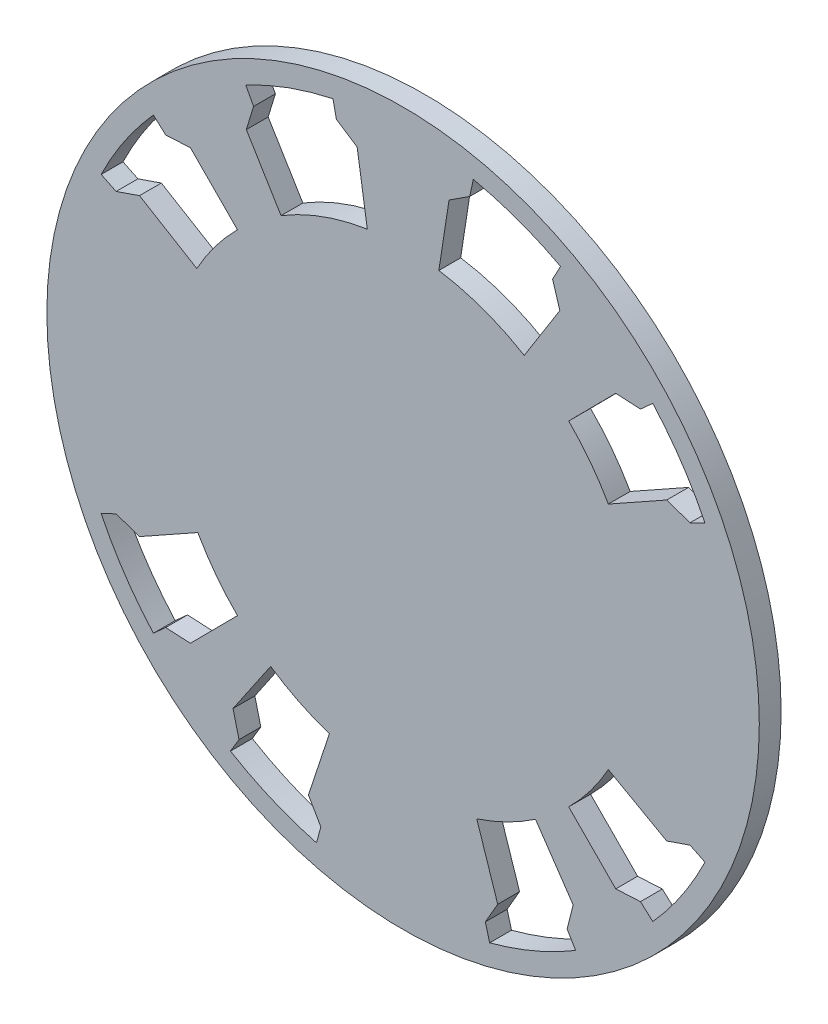
from build123d import *

# Parameters (mm, degrees)
SKETCH1_R           = 53
BOSS_EXTRUDE2_DEPTH = 3.25


with BuildPart() as part:
    # Sketch1 → Boss-Extrude2 (new body)
    with BuildSketch(Plane.XY):
        with Locations((4.870724861, -1.696758811)):
            Circle(SKETCH1_R)
        with BuildLine():
            Line((47.566786932, -22.464700122), (49.787097659, -23.547618021))
            ThreePointArc((49.787097659, -23.547618021), (46.308922772, -29.586117847), (42.024200497, -35.081783024))
            Line((42.024200497, -35.081783024), (40.188393468, -33.42881495))
            Line((40.188393468, -33.42881495), (36.513472454, -33.621409399))
            Line((36.513472454, -33.621409399), (29.509466442, -26.555005195))
            ThreePointArc((29.509466442, -26.555005195), (32.729283137, -22.88403638), (35.406864683, -18.800681308))
            Line((35.406864683, -18.800681308), (44.08731235, -23.662779301))
            Line((44.08731235, -23.662779301), (47.566786932, -22.464700122))
        make_face(mode=Mode.SUBTRACT)
        with BuildLine():
            Line((47.566786932, 19.071182501), (44.08731235, 20.26926168))
            Line((44.08731235, 20.26926168), (35.406864683, 15.407163687))
            ThreePointArc((35.406864683, 15.407163687), (32.729283137, 19.490518759), (29.509466442, 23.161487574))
            Line((29.509466442, 23.161487574), (36.513472454, 30.227891778))
            Line((36.513472454, 30.227891778), (40.188393468, 30.035297329))
            Line((40.188393468, 30.035297329), (42.024200497, 31.688265402))
            ThreePointArc((42.024200497, 31.688265402), (46.308922772, 26.192600226), (49.787097659, 20.1541004))
            Line((49.787097659, 20.1541004), (47.566786932, 19.071182501))
        make_face(mode=Mode.SUBTRACT)
        with BuildLine():
            Line((28.299596439, 42.474362712), (27.116085982, 40.248503273))
            Line((27.116085982, 40.248503273), (28.192003411, 36.729335933))
            Line((28.192003411, 36.729335933), (22.897057483, 28.304096714))
            ThreePointArc((22.897057483, 28.304096714), (16.768473858, 31.218945174), (10.192574898, 32.896273901))
            Line((10.192574898, 32.896273901), (11.705406612, 42.729966432))
            Line((11.705406612, 42.729966432), (14.791684342, 44.734218625))
            Line((14.791684342, 44.734218625), (15.315817601, 47.200071738))
            ThreePointArc((15.315817601, 47.200071738), (21.971732028, 45.287872229), (28.299596439, 42.474362712))
        make_face(mode=Mode.SUBTRACT)
        with BuildLine():
            ThreePointArc((-18.5343822, 42.429668157), (-12.212969352, 45.240305281), (-5.563843448, 47.150558185))
            Line((-5.563843448, 47.150558185), (-5.05023462, 44.734218625))
            Line((-5.05023462, 44.734218625), (-1.963956889, 42.729966432))
            Line((-1.963956889, 42.729966432), (-0.451125175, 32.896273901))
            ThreePointArc((-0.451125175, 32.896273901), (-7.099980155, 31.192482917), (-13.288474299, 28.223860933))
            Line((-13.288474299, 28.223860933), (-18.450553688, 36.729335933))
            Line((-18.450553688, 36.729335933), (-17.374636259, 40.248503273))
            Line((-17.374636259, 40.248503273), (-18.5343822, 42.429668157))
        make_face(mode=Mode.SUBTRACT)
        with BuildLine():
            ThreePointArc((-40.045647936, 20.1541004), (-36.567473049, 26.192600226), (-32.282750775, 31.688265402))
            Line((-32.282750775, 31.688265402), (-30.446943745, 30.035297329))
            Line((-30.446943745, 30.035297329), (-26.772022731, 30.227891778))
            Line((-26.772022731, 30.227891778), (-19.76801672, 23.161487574))
            ThreePointArc((-19.76801672, 23.161487574), (-23.079377371, 19.369607397), (-25.812491143, 15.141894807))
            Line((-25.812491143, 15.141894807), (-34.345862627, 20.26926168))
            Line((-34.345862627, 20.26926168), (-37.825337209, 19.071182501))
            Line((-37.825337209, 19.071182501), (-40.045647936, 20.1541004))
        make_face(mode=Mode.SUBTRACT)
        with BuildLine():
            ThreePointArc((-32.282750775, -35.081783024), (-36.567473049, -29.586117847), (-40.045647936, -23.547618021))
            Line((-40.045647936, -23.547618021), (-37.825337209, -22.464700122))
            Line((-37.825337209, -22.464700122), (-34.345862627, -23.662779301))
            Line((-34.345862627, -23.662779301), (-25.66541496, -18.800681308))
            ThreePointArc((-25.66541496, -18.800681308), (-22.987833414, -22.88403638), (-19.76801672, -26.555005195))
            Line((-19.76801672, -26.555005195), (-26.772022731, -33.621409399))
            Line((-26.772022731, -33.621409399), (-30.446943745, -33.42881495))
            Line((-30.446943745, -33.42881495), (-32.282750775, -35.081783024))
        make_face(mode=Mode.SUBTRACT)
        with BuildLine():
            ThreePointArc((-8.008224552, -49.957231825), (-14.599447184, -47.695160892), (-20.811705065, -44.537783385))
            Line((-20.811705065, -44.537783385), (-19.539395166, -42.420304124))
            Line((-19.539395166, -42.420304124), (-20.4296591, -38.849650513))
            Line((-20.4296591, -38.849650513), (-14.829511994, -30.625994332))
            ThreePointArc((-14.829511994, -30.625994332), (-10.611619227, -33.086200053), (-6.092380244, -34.935446006))
            Line((-6.092380244, -34.935446006), (-9.208840303, -44.384141433))
            Line((-9.208840303, -44.384141433), (-7.368858164, -47.571083983))
            Line((-7.368858164, -47.571083983), (-8.008224552, -49.957231825))
        make_face(mode=Mode.SUBTRACT)
        with BuildLine():
            ThreePointArc((30.553154788, -44.537783385), (24.340896907, -47.695160892), (17.749674274, -49.957231825))
            Line((17.749674274, -49.957231825), (17.110307887, -47.571083983))
            Line((17.110307887, -47.571083983), (18.950290026, -44.384141433))
            Line((18.950290026, -44.384141433), (15.833829966, -34.935446006))
            ThreePointArc((15.833829966, -34.935446006), (20.35306895, -33.086200053), (24.570961717, -30.625994332))
            Line((24.570961717, -30.625994332), (30.171108822, -38.849650513))
            Line((30.171108822, -38.849650513), (29.280844889, -42.420304124))
            Line((29.280844889, -42.420304124), (30.553154788, -44.537783385))
        make_face(mode=Mode.SUBTRACT)
    extrude(amount=BOSS_EXTRUDE2_DEPTH)


solid = part.part
